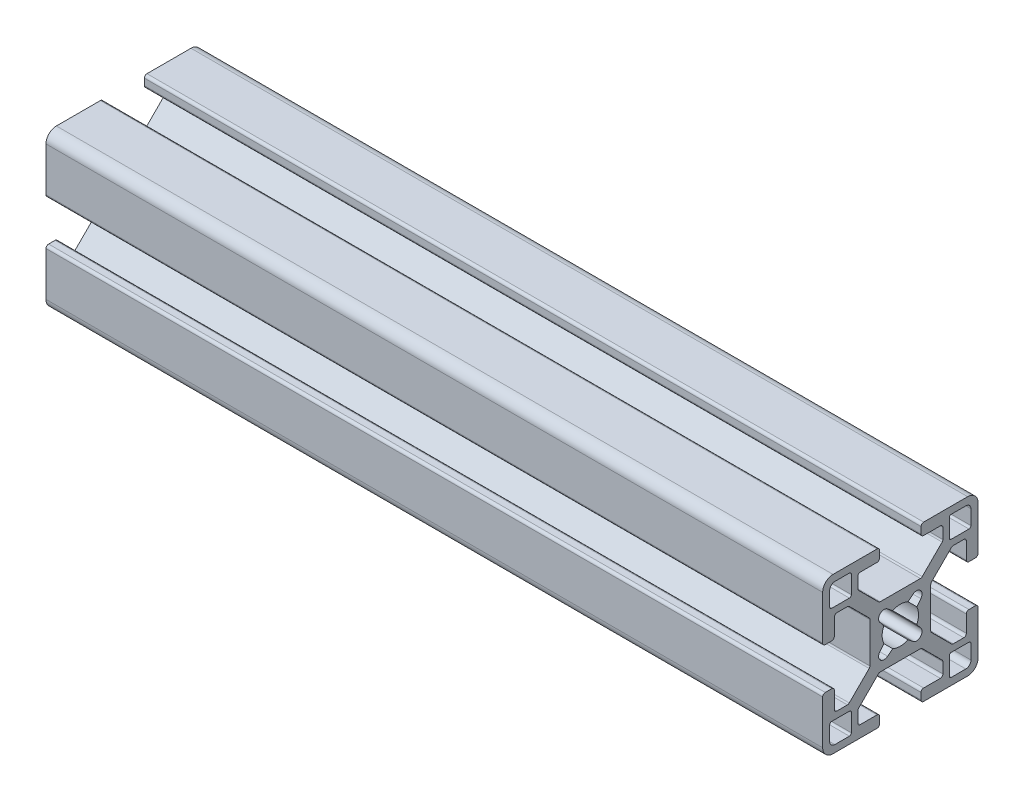
from build123d import *

# Parameters (mm, degrees)
PERFIL_COM_ALUMINIO_PERFIL_COMER_30_X_DEPTH = 150


with BuildPart() as part:
    # Esboço1 → Perfil com. aluminio PERFIL COMER. 30 X 30(1) (new body)
    with BuildSketch(Plane(origin=(0, 0, 0), x_dir=(0, 0, -1), z_dir=(1, 0, 0))):
        with BuildLine():
            Line((0, 5.872725395), (-3.872893219, 5.872725395))
            ThreePointArc((-3.872893219, 5.872725395), (-4.064234935, 5.910785628), (-4.226446609, 6.019172004))
            Line((-4.226446609, 6.019172004), (-8.073553391, 9.866278785))
            ThreePointArc((-8.073553391, 9.866278785), (-8.181939766, 10.02849046), (-8.22, 10.219832176))
            Line((-8.22, 10.219832176), (-8.22, 12.25))
            ThreePointArc((-8.22, 12.25), (-8.073553391, 12.603553391), (-7.72, 12.75))
            Line((-7.72, 12.75), (-4.5, 12.75))
            ThreePointArc((-4.5, 12.75), (-4.146446609, 12.896446609), (-4, 13.25))
            Line((-4, 13.25), (-4, 14.5))
            ThreePointArc((-4, 14.5), (-4.146446609, 14.853553391), (-4.5, 15))
            Line((-4.5, 15), (-13, 15))
            ThreePointArc((-13, 15), (-14.414213562, 14.414213562), (-15, 13))
            Line((-15, 13), (-15, 4.5))
            ThreePointArc((-15, 4.5), (-14.853553391, 4.146446609), (-14.5, 4))
            Line((-14.5, 4), (-13.25, 4))
            ThreePointArc((-13.25, 4), (-12.896446609, 4.146446609), (-12.75, 4.5))
            Line((-12.75, 4.5), (-12.75, 7.72))
            ThreePointArc((-12.75, 7.72), (-12.603553391, 8.073553391), (-12.25, 8.22))
            Line((-12.25, 8.22), (-10.219832176, 8.22))
            ThreePointArc((-10.219832176, 8.22), (-10.02849046, 8.181939766), (-9.866278785, 8.073553391))
            Line((-9.866278785, 8.073553391), (-6.019172004, 4.226446609))
            ThreePointArc((-6.019172004, 4.226446609), (-5.910785628, 4.064234935), (-5.872725395, 3.872893219))
            Line((-5.872725395, 3.872893219), (-5.872725395, 0))
            Line((-5.872725395, 0), (-5.872725395, -3.872893219))
            ThreePointArc((-5.872725395, -3.872893219), (-5.910785628, -4.064234935), (-6.019172004, -4.226446609))
            Line((-6.019172004, -4.226446609), (-9.866278785, -8.073553391))
            ThreePointArc((-9.866278785, -8.073553391), (-10.02849046, -8.181939766), (-10.219832176, -8.22))
            Line((-10.219832176, -8.22), (-12.25, -8.22))
            ThreePointArc((-12.25, -8.22), (-12.603553391, -8.073553391), (-12.75, -7.72))
            Line((-12.75, -7.72), (-12.75, -4.5))
            ThreePointArc((-12.75, -4.5), (-12.896446609, -4.146446609), (-13.25, -4))
            Line((-13.25, -4), (-14.5, -4))
            ThreePointArc((-14.5, -4), (-14.853553391, -4.146446609), (-15, -4.5))
            Line((-15, -4.5), (-15, -13))
            ThreePointArc((-15, -13), (-14.414213562, -14.414213562), (-13, -15))
            Line((-13, -15), (-4.5, -15))
            ThreePointArc((-4.5, -15), (-4.146446609, -14.853553391), (-4, -14.5))
            Line((-4, -14.5), (-4, -13.25))
            ThreePointArc((-4, -13.25), (-4.146446609, -12.896446609), (-4.5, -12.75))
            Line((-4.5, -12.75), (-7.72, -12.75))
            ThreePointArc((-7.72, -12.75), (-8.073553391, -12.603553391), (-8.22, -12.25))
            Line((-8.22, -12.25), (-8.22, -10.219832176))
            ThreePointArc((-8.22, -10.219832176), (-8.181939766, -10.02849046), (-8.073553391, -9.866278785))
            Line((-8.073553391, -9.866278785), (-4.226446609, -6.019172004))
            ThreePointArc((-4.226446609, -6.019172004), (-4.064234935, -5.910785628), (-3.872893219, -5.872725395))
            Line((-3.872893219, -5.872725395), (0, -5.872725395))
            Line((0, -5.872725395), (3.872893219, -5.872725395))
            ThreePointArc((3.872893219, -5.872725395), (4.064234935, -5.910785628), (4.226446609, -6.019172004))
            Line((4.226446609, -6.019172004), (8.073553391, -9.866278785))
            ThreePointArc((8.073553391, -9.866278785), (8.181939766, -10.02849046), (8.22, -10.219832176))
            Line((8.22, -10.219832176), (8.22, -12.25))
            ThreePointArc((8.22, -12.25), (8.073553391, -12.603553391), (7.72, -12.75))
            Line((7.72, -12.75), (4.5, -12.75))
            ThreePointArc((4.5, -12.75), (4.146446609, -12.896446609), (4, -13.25))
            Line((4, -13.25), (4, -14.5))
            ThreePointArc((4, -14.5), (4.146446609, -14.853553391), (4.5, -15))
            Line((4.5, -15), (13, -15))
            ThreePointArc((13, -15), (14.414213562, -14.414213562), (15, -13))
            Line((15, -13), (15, -4.5))
            ThreePointArc((15, -4.5), (14.853553391, -4.146446609), (14.5, -4))
            Line((14.5, -4), (13.25, -4))
            ThreePointArc((13.25, -4), (12.896446609, -4.146446609), (12.75, -4.5))
            Line((12.75, -4.5), (12.75, -7.72))
            ThreePointArc((12.75, -7.72), (12.603553391, -8.073553391), (12.25, -8.22))
            Line((12.25, -8.22), (10.219832176, -8.22))
            ThreePointArc((10.219832176, -8.22), (10.02849046, -8.181939766), (9.866278785, -8.073553391))
            Line((9.866278785, -8.073553391), (6.019172004, -4.226446609))
            ThreePointArc((6.019172004, -4.226446609), (5.910785628, -4.064234935), (5.872725395, -3.872893219))
            Line((5.872725395, -3.872893219), (5.872725395, 0))
            Line((5.872725395, 0), (5.872725395, 3.872893219))
            ThreePointArc((5.872725395, 3.872893219), (5.910785628, 4.064234935), (6.019172004, 4.226446609))
            Line((6.019172004, 4.226446609), (9.866278785, 8.073553391))
            ThreePointArc((9.866278785, 8.073553391), (10.02849046, 8.181939766), (10.219832176, 8.22))
            Line((10.219832176, 8.22), (12.25, 8.22))
            ThreePointArc((12.25, 8.22), (12.603553391, 8.073553391), (12.75, 7.72))
            Line((12.75, 7.72), (12.75, 4.5))
            ThreePointArc((12.75, 4.5), (12.896446609, 4.146446609), (13.25, 4))
            Line((13.25, 4), (14.5, 4))
            ThreePointArc((14.5, 4), (14.853553391, 4.146446609), (15, 4.5))
            Line((15, 4.5), (15, 13))
            ThreePointArc((15, 13), (14.414213562, 14.414213562), (13, 15))
            Line((13, 15), (4.5, 15))
            ThreePointArc((4.5, 15), (4.146446609, 14.853553391), (4, 14.5))
            Line((4, 14.5), (4, 13.25))
            ThreePointArc((4, 13.25), (4.146446609, 12.896446609), (4.5, 12.75))
            Line((4.5, 12.75), (7.72, 12.75))
            ThreePointArc((7.72, 12.75), (8.073553391, 12.603553391), (8.22, 12.25))
            Line((8.22, 12.25), (8.22, 10.219832176))
            ThreePointArc((8.22, 10.219832176), (8.181939766, 10.02849046), (8.073553391, 9.866278785))
            Line((8.073553391, 9.866278785), (4.226446609, 6.019172004))
            ThreePointArc((4.226446609, 6.019172004), (4.064234935, 5.910785628), (3.872893219, 5.872725395))
            Line((3.872893219, 5.872725395), (0, 5.872725395))
        make_face()
        with BuildLine():
            Line((-3.184880901, 1.488031663), (-3.963428513, 2.463089414))
            ThreePointArc((-3.963428513, 2.463089414), (-3.884059168, 3.884060272), (-2.463088278, 3.963429044))
            Line((-2.463088278, 3.963429044), (-1.488030527, 3.184881432))
            ThreePointArc((-1.488030527, 3.184881432), (-0.762142415, 3.431740597), (6.27e-07, 3.515352697))
            ThreePointArc((6.27e-07, 3.515352697), (0.762143639, 3.431740325), (1.488031663, 3.184880901))
            Line((1.488031663, 3.184880901), (2.463089414, 3.963428513))
            ThreePointArc((2.463089414, 3.963428513), (3.884060272, 3.884059168), (3.963429044, 2.463088278))
            Line((3.963429044, 2.463088278), (3.184881432, 1.488030527))
            ThreePointArc((3.184881432, 1.488030527), (3.431740597, 0.762142415), (3.515352697, -6.27e-07))
            ThreePointArc((3.515352697, -6.27e-07), (3.431740325, -0.762143639), (3.184880901, -1.488031663))
            Line((3.184880901, -1.488031663), (3.963428513, -2.463089414))
            ThreePointArc((3.963428513, -2.463089414), (3.884059168, -3.884060272), (2.463088278, -3.963429044))
            Line((2.463088278, -3.963429044), (1.488030527, -3.184881432))
            ThreePointArc((1.488030527, -3.184881432), (0.762142415, -3.431740597), (-6.27e-07, -3.515352697))
            ThreePointArc((-6.27e-07, -3.515352697), (-0.762143639, -3.431740325), (-1.488031663, -3.184880901))
            Line((-1.488031663, -3.184880901), (-2.463089414, -3.963428513))
            ThreePointArc((-2.463089414, -3.963428513), (-3.884060272, -3.884059168), (-3.963429044, -2.463088278))
            Line((-3.963429044, -2.463088278), (-3.184881432, -1.488030527))
            ThreePointArc((-3.184881432, -1.488030527), (-3.431740597, -0.762142415), (-3.515352697, 6.27e-07))
            ThreePointArc((-3.515352697, 6.27e-07), (-3.431740325, 0.762143639), (-3.184880901, 1.488031663))
        make_face(mode=Mode.SUBTRACT)
        with BuildLine():
            Line((-9.46, 13.26), (-9.46, 9.84))
            ThreePointArc((-9.46, 9.84), (-9.571299423, 9.571299423), (-9.84, 9.46))
            Line((-9.84, 9.46), (-13.26, 9.46))
            ThreePointArc((-13.26, 9.46), (-13.528700577, 9.571299423), (-13.64, 9.84))
            Line((-13.64, 9.84), (-13.64, 12.64))
            ThreePointArc((-13.64, 12.64), (-13.347106781, 13.347106781), (-12.64, 13.64))
            Line((-12.64, 13.64), (-9.84, 13.64))
            ThreePointArc((-9.84, 13.64), (-9.571299423, 13.528700577), (-9.46, 13.26))
        make_face(mode=Mode.SUBTRACT)
        with BuildLine():
            Line((13.64, 12.64), (13.64, 9.84))
            ThreePointArc((13.64, 9.84), (13.528700577, 9.571299423), (13.26, 9.46))
            Line((13.26, 9.46), (9.84, 9.46))
            ThreePointArc((9.84, 9.46), (9.571299423, 9.571299423), (9.46, 9.84))
            Line((9.46, 9.84), (9.46, 13.26))
            ThreePointArc((9.46, 13.26), (9.571299423, 13.528700577), (9.84, 13.64))
            Line((9.84, 13.64), (12.64, 13.64))
            ThreePointArc((12.64, 13.64), (13.347106781, 13.347106781), (13.64, 12.64))
        make_face(mode=Mode.SUBTRACT)
        with BuildLine():
            Line((12.64, -13.64), (9.84, -13.64))
            ThreePointArc((9.84, -13.64), (9.571299423, -13.528700577), (9.46, -13.26))
            Line((9.46, -13.26), (9.46, -9.84))
            ThreePointArc((9.46, -9.84), (9.571299423, -9.571299423), (9.84, -9.46))
            Line((9.84, -9.46), (13.26, -9.46))
            ThreePointArc((13.26, -9.46), (13.528700577, -9.571299423), (13.64, -9.84))
            Line((13.64, -9.84), (13.64, -12.64))
            ThreePointArc((13.64, -12.64), (13.347106781, -13.347106781), (12.64, -13.64))
        make_face(mode=Mode.SUBTRACT)
        with BuildLine():
            Line((-13.64, -12.64), (-13.64, -9.84))
            ThreePointArc((-13.64, -9.84), (-13.528700577, -9.571299423), (-13.26, -9.46))
            Line((-13.26, -9.46), (-9.84, -9.46))
            ThreePointArc((-9.84, -9.46), (-9.571299423, -9.571299423), (-9.46, -9.84))
            Line((-9.46, -9.84), (-9.46, -13.26))
            ThreePointArc((-9.46, -13.26), (-9.571299423, -13.528700577), (-9.84, -13.64))
            Line((-9.84, -13.64), (-12.64, -13.64))
            ThreePointArc((-12.64, -13.64), (-13.347106781, -13.347106781), (-13.64, -12.64))
        make_face(mode=Mode.SUBTRACT)
    extrude(amount=PERFIL_COM_ALUMINIO_PERFIL_COMER_30_X_DEPTH)


solid = part.part
